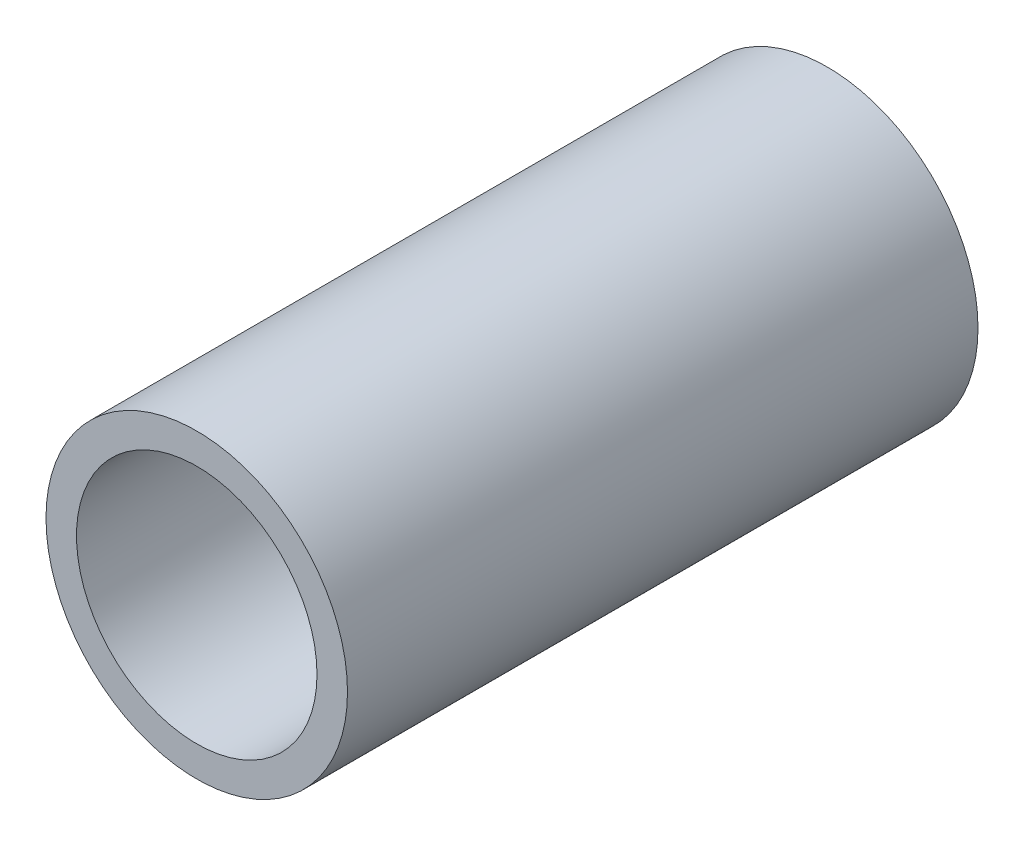
from build123d import *

# Parameters (mm, degrees)
SKETCH1_R           = 16.7005
SKETCH1_R_2         = 13.3223
EXTRUDE_THIN1_DEPTH = 34.925


with BuildPart() as part:
    # Sketch1 → Extrude-Thin1 (new, symmetric)
    with BuildSketch(Plane.XY):
        Circle(SKETCH1_R)
        Circle(SKETCH1_R_2, mode=Mode.SUBTRACT)
    extrude(amount=EXTRUDE_THIN1_DEPTH, both=True)


solid = part.part
